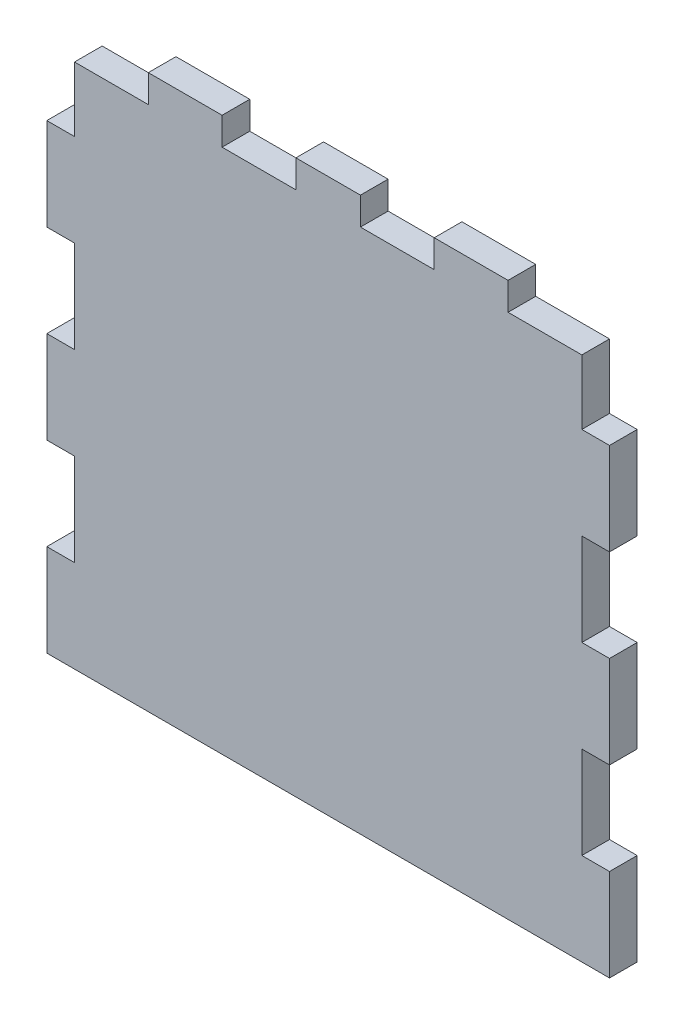
from build123d import *

# Parameters (mm, degrees)
SKETCH1_W           = 3
SKETCH1_H           = 10
SKETCH1_W_2         = 27.5
SKETCH1_H_2         = 3
SKETCH1_W_3         = 8
SKETCH1_W_4         = 3.5
BOSS_EXTRUDE1_DEPTH = 3


with BuildPart() as part:
    # Sketch1 → Boss-Extrude1 (new body)
    with BuildSketch(Plane.XY):
        with Locations((-29, -15)):
            Rectangle(SKETCH1_W, SKETCH1_H)
        with Locations((-29, -35)):
            Rectangle(SKETCH1_W, SKETCH1_H)
        Polygon((-27.5, -60), (-27.5, -57), (-27.5, -50), (-30.5, -50), (-30.5, -60), align=None)
        Polygon((0, -57), (0, -3), (-3.5, -3), (-11.5, -3), (-19.5, -3), (-27.5, -3), (-27.5, -10), (-27.5, -20), (-27.5, -30), (-27.5, -40), (-27.5, -50), (-27.5, -57), align=None)
        Polygon((27.5, -10), (27.5, -3), (19.5, -3), (11.5, -3), (3.5, -3), (0, -3), (0, -57), (27.5, -57), (27.5, -50), (27.5, -40), (27.5, -30), (27.5, -20), align=None)
        with Locations((-13.75, -58.5)):
            Rectangle(SKETCH1_W_2, SKETCH1_H_2)
        with Locations((13.75, -58.5)):
            Rectangle(SKETCH1_W_2, SKETCH1_H_2)
        Polygon((30.5, -50), (27.5, -50), (27.5, -57), (27.5, -60), (30.5, -60), align=None)
        with Locations((29, -35)):
            Rectangle(SKETCH1_W, SKETCH1_H)
        with Locations((29, -15)):
            Rectangle(SKETCH1_W, SKETCH1_H)
        with Locations((15.5, -1.5)):
            Rectangle(SKETCH1_W_3, SKETCH1_H_2)
        with Locations((1.75, -1.5)):
            Rectangle(SKETCH1_W_4, SKETCH1_H_2)
        with Locations((-1.75, -1.5)):
            Rectangle(SKETCH1_W_4, SKETCH1_H_2)
        with Locations((-15.5, -1.5)):
            Rectangle(SKETCH1_W_3, SKETCH1_H_2)
    extrude(amount=BOSS_EXTRUDE1_DEPTH)


solid = part.part
